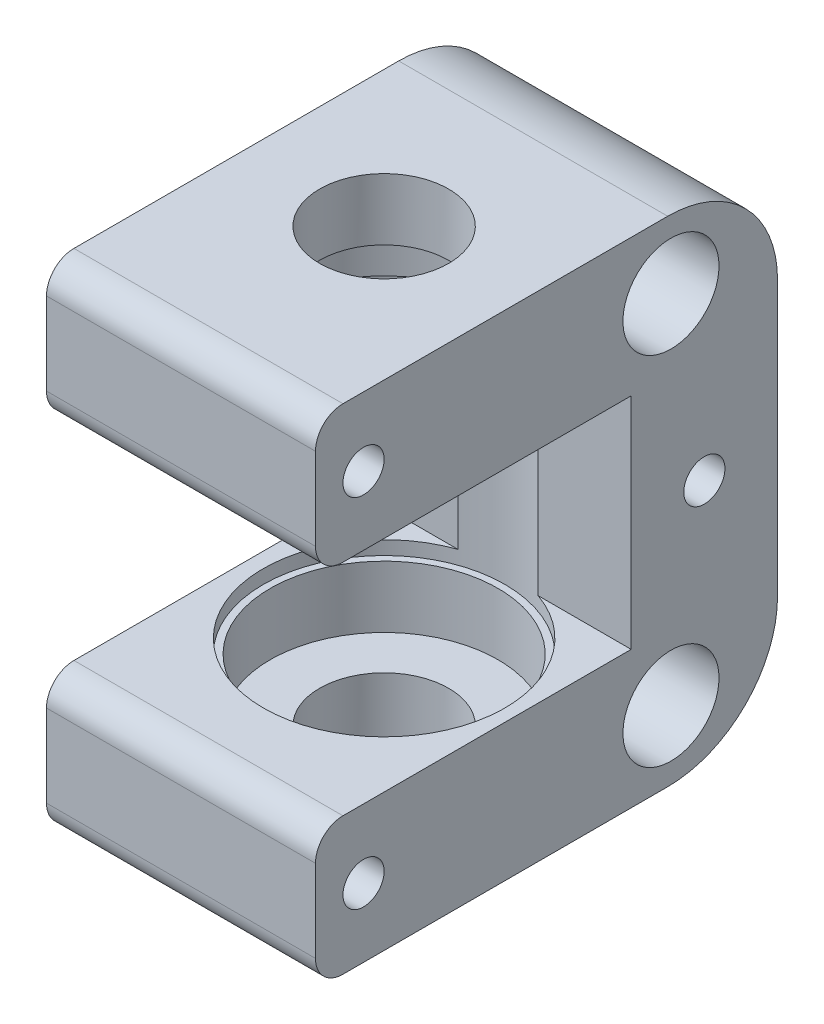
from build123d import *

# Parameters (mm, degrees)
SZKIC1_R                         = 3
DODANIE_WYCI_GNI_CIE1_DEPTH      = 60
WYTNIJ_WYCI_GNI_CIE1_START       = 43
SZKIC1_4_R                       = 8.3
WYTNIJ_WYCI_GNI_CIE1_DEPTH       = 26
WYTNIJ_WYCI_GNI_CIE2_START       = 38
WYTNIJ_WYCI_GNI_CIE2_DEPTH       = 16
WYTNIJ_WYCI_GNI_CIE3_START       = -12
WYTNIJ_WYCI_GNI_CIE3_DEPTH       = 12
WYTNIJ_WYCI_GNI_CIE4_DEPTH       = 12
WYTNIJ_WYCI_GNI_CIE5_START       = -26
WYTNIJ_WYCI_GNI_CIE5_DEPTH       = 16
SZKIC7_W                         = 1.4
SZKIC7_H                         = 16
WYTNIJ_WYCI_GNI_CIE6_DEPTH       = 527.501957094
SZKIC8_W                         = 5
SZKIC8_H                         = 10
DODANIE_WYCI_GNI_CIE2_DEPTH      = 16
DODANIE_WYCI_GNI_CIE3_DEPTH      = 10
DODANIE_WYCI_GNI_CIE4_DEPTH      = 10
SZKIC11_W                        = 6.4
SZKIC11_H                        = 16
DODANIE_WYCI_GNI_CIE5_DEPTH      = 11
DODANIE_WYCI_GNI_CIE6_DEPTH      = 10
DODANIE_WYCI_GNI_CIE7_START      = -10
DODANIE_WYCI_GNI_CIE7_DEPTH      = 10
SZKIC15_W                        = 6.4
SZKIC15_H                        = 16
DODANIE_WYCI_GNI_CIE8_DEPTH      = 3.4
SZKIC8_3_R                       = 1.5
WYTNIJ_WYCI_GNI_CIE7_DEPTH       = 527.66242587
SZKIC16_R                        = 4.7
WYTNIJ_WYCI_GNI_CIE8_DEPTH       = 526.928654544
WYTNIJ_WYCI_GNI_CIE9_START       = -0.5
SZKIC17_R                        = 8.3
WYTNIJ_WYCI_GNI_CIE9_DEPTH       = 0.5
SZKIC18_R                        = 8.3
WYTNIJ_WYCI_GNI_CIE10_DEPTH      = 0.5
SZKIC19_W                        = 28.661365339
SZKIC19_H                        = 12
WYTNIJ_WYCI_GNI_CIE11_DEPTH      = 527.501957094
SZKIC20_W                        = 4.261365339
SZKIC20_H                        = 36
DODANIE_WYCI_GNI_CIE9_DEPTH      = 14.4
SZKIC21_R                        = 1.8
SZKIC21_R_2                      = 1.5
WYTNIJ_WYCI_GNI_CIE12_DEPTH      = 526.430595629
SZKIC21_3_R                      = 1.5
WYTNIJ_WYCI_GNI_CIE13_DEPTH      = 16
ZAOKR_GLENIE1_R                  = 8
ZAOKR_GLENIE2_R                  = 2
SZKIC22_R                        = 3.5
WYTNIJ_WYCI_GNI_CIE14_DEPTH      = 5
WYTNIJ_WYCI_GNI_CIE15_DEPTH      = 17
WYTNIJ_WYCI_GNI_CIE15_DEPTH_BACK = 1
SZKIC23_R                        = 8.8
DODANIE_WYCI_GNI_CIE10_START     = 0.2
DODANIE_WYCI_GNI_CIE10_DEPTH     = 0.2


with BuildPart() as part:
    # Szkic1 → Dodanie-wyciągnięcie1 (new body)
    with BuildSketch(Plane(origin=(0, 0, 0), x_dir=(1, 0, 0), z_dir=(0, 1, 0))):
        with BuildLine():
            Line((-24.999980785, 522.873742718), (-29.999980785, 522.873742718))
            Line((-29.999980785, 522.873742718), (-29.999980785, 494.212377379))
            Line((-29.999980785, 494.212377379), (-20.299980785, 494.212377379))
            ThreePointArc((-20.299980785, 494.212377379), (-10.599980785, 503.912377379), (-20.299980785, 513.612377379))
            Line((-20.299980785, 513.612377379), (-24.999980785, 513.612377379))
            Line((-24.999980785, 513.612377379), (-24.999980785, 522.873742718))
        make_face()
        with Locations(Location((-20.299980785, 503.912377379, 0), (0, 0, 270))):
            Circle(SZKIC1_R, mode=Mode.SUBTRACT)
    extrude(amount=DODANIE_WYCI_GNI_CIE1_DEPTH)

    # Szkic1<4> → Wytnij-wyciągnięcie1 (cut)
    with BuildSketch(Plane(origin=(0, 0, 0), x_dir=(1, 0, 0), z_dir=(0, 1, 0)).offset(WYTNIJ_WYCI_GNI_CIE1_START)):
        with Locations(Location((-20.299980785, 503.912377379, 0), (0, 0, 270))):
            Circle(SZKIC1_4_R)
    extrude(amount=-WYTNIJ_WYCI_GNI_CIE1_DEPTH, mode=Mode.SUBTRACT)

    # Szkic1<6> → Wytnij-wyciągnięcie2 (cut)
    with BuildSketch(Plane(origin=(0, 0, 0), x_dir=(1, 0, 0), z_dir=(0, 1, 0)).offset(WYTNIJ_WYCI_GNI_CIE2_START)):
        with BuildLine():
            Line((-20.299980785, 512.212377379), (-29.999980785, 512.212377379))
            Line((-29.999980785, 512.212377379), (-29.999980785, 495.612377379))
            Line((-29.999980785, 495.612377379), (-20.299980785, 495.612377379))
            ThreePointArc((-20.299980785, 495.612377379), (-28.599980785, 503.912377379), (-20.299980785, 512.212377379))
        make_face()
    extrude(amount=-WYTNIJ_WYCI_GNI_CIE2_DEPTH, mode=Mode.SUBTRACT)

    # Szkic3 → Wytnij-wyciągnięcie3 (cut)
    with BuildSketch(Plane(origin=(0, 60, 0), x_dir=(1, 0, 0), z_dir=(0, 1, 0)).offset(WYTNIJ_WYCI_GNI_CIE3_START)):
        with BuildLine():
            Line((-24.999980785, 513.612377379), (-24.999980785, 494.212377379))
            Line((-24.999980785, 494.212377379), (-20.299980785, 494.212377379))
            ThreePointArc((-20.299980785, 494.212377379), (-10.599980785, 503.912377379), (-20.299980785, 513.612377379))
            Line((-20.299980785, 513.612377379), (-24.999980785, 513.612377379))
        make_face()
    extrude(amount=WYTNIJ_WYCI_GNI_CIE3_DEPTH, mode=Mode.SUBTRACT)

    # Szkic5 → Wytnij-wyciągnięcie4 (cut)
    with BuildSketch(Plane.XZ):
        with BuildLine():
            Line((-24.999980785, -513.612377379), (-20.299980785, -513.612377379))
            ThreePointArc((-20.299980785, -513.612377379), (-10.599980785, -503.912377379), (-20.299980785, -494.212377379))
            Line((-20.299980785, -494.212377379), (-24.999980785, -494.212377379))
            Line((-24.999980785, -494.212377379), (-24.999980785, -513.612377379))
        make_face()
    extrude(amount=-WYTNIJ_WYCI_GNI_CIE4_DEPTH, mode=Mode.SUBTRACT)

    # Szkic6 → Wytnij-wyciągnięcie5 (cut)
    with BuildSketch(Plane(origin=(0, 48, 0), x_dir=(1, 0, 0), z_dir=(0, 1, 0)).offset(WYTNIJ_WYCI_GNI_CIE5_START)):
        with BuildLine():
            Line((-20.299980785, 513.612377379), (-24.999980785, 513.612377379))
            Line((-24.999980785, 513.612377379), (-24.999980785, 494.212377379))
            Line((-24.999980785, 494.212377379), (-20.299980785, 494.212377379))
            ThreePointArc((-20.299980785, 494.212377379), (-10.599980785, 503.912377379), (-20.299980785, 513.612377379))
        make_face()
    extrude(amount=WYTNIJ_WYCI_GNI_CIE5_DEPTH, mode=Mode.SUBTRACT)

    # Szkic7 → Wytnij-wyciągnięcie6 (cut, through all)
    with BuildSketch(Plane(origin=(-24.999980785, 0, 0), x_dir=(0, 0, -1), z_dir=(1, 0, 0))):
        with Locations((494.912377379, 30)):
            Rectangle(SZKIC7_W, SZKIC7_H)
    extrude(amount=-WYTNIJ_WYCI_GNI_CIE6_DEPTH, mode=Mode.SUBTRACT)

    # Szkic8 → Dodanie-wyciągnięcie2 (add)
    with BuildSketch(Plane.ZY.offset(29.999980785)):
        with Locations((-491.712377379, 43)):
            Rectangle(SZKIC8_W, SZKIC8_H)
        with Locations((-516.112377379, 43)):
            Rectangle(SZKIC8_W, SZKIC8_H)
        with Locations((-516.112377379, 17)):
            Rectangle(SZKIC8_W, SZKIC8_H)
        with Locations((-491.712377379, 17)):
            Rectangle(SZKIC8_W, SZKIC8_H)
    extrude(amount=-DODANIE_WYCI_GNI_CIE2_DEPTH)

    # Szkic9 → Dodanie-wyciągnięcie3 (add)
    with BuildSketch(Plane.XZ.offset(-12)):
        with BuildLine():
            Line((-13.999980785, -513.612377379), (-20.299980785, -513.612377379))
            ThreePointArc((-20.299980785, -513.612377379), (-16.942426987, -513.012752783), (-13.999980785, -511.288012944))
            Line((-13.999980785, -511.288012944), (-13.999980785, -513.612377379))
        make_face()
        with BuildLine():
            Line((-13.999980785, -494.212377379), (-20.299980785, -494.212377379))
            ThreePointArc((-20.299980785, -494.212377379), (-16.942426987, -494.812001974), (-13.999980785, -496.536741813))
            Line((-13.999980785, -496.536741813), (-13.999980785, -494.212377379))
        make_face()
    extrude(amount=-DODANIE_WYCI_GNI_CIE3_DEPTH)

    # Szkic10 → Dodanie-wyciągnięcie4 (add)
    with BuildSketch(Plane.XZ.offset(-38)):
        with BuildLine():
            Line((-13.999980785, -513.612377379), (-20.299980785, -513.612377379))
            ThreePointArc((-20.299980785, -513.612377379), (-16.942426987, -513.012752783), (-13.999980785, -511.288012944))
            Line((-13.999980785, -511.288012944), (-13.999980785, -513.612377379))
        make_face()
        with BuildLine():
            Line((-13.999980785, -494.212377379), (-13.999980785, -496.536741813))
            ThreePointArc((-13.999980785, -496.536741813), (-16.942426987, -494.812001974), (-20.299980785, -494.212377379))
            Line((-20.299980785, -494.212377379), (-13.999980785, -494.212377379))
        make_face()
    extrude(amount=-DODANIE_WYCI_GNI_CIE4_DEPTH)

    # Szkic11 → Dodanie-wyciągnięcie5 (add)
    with BuildSketch(Plane(origin=(-24.999980785, 0, 0), x_dir=(0, 0, -1), z_dir=(1, 0, 0))):
        with Locations((515.412377379, 30)):
            Rectangle(SZKIC11_W, SZKIC11_H)
    extrude(amount=DODANIE_WYCI_GNI_CIE5_DEPTH)

    # Szkic12 → Dodanie-wyciągnięcie6 (add)
    with BuildSketch(Plane.XZ.offset(-12)):
        with BuildLine():
            ThreePointArc((-13.999980785, -496.536741813), (-11.490894566, -499.851589278), (-10.599980785, -503.912377379))
            Line((-10.599980785, -503.912377379), (-10.599980785, -489.212377379))
            Line((-10.599980785, -489.212377379), (-13.999980785, -489.212377379))
            Line((-13.999980785, -489.212377379), (-13.999980785, -496.536741813))
        make_face()
        with BuildLine():
            Line((-13.999980785, -511.288012944), (-13.999980785, -518.612377379))
            Line((-13.999980785, -518.612377379), (-10.599980785, -518.612377379))
            Line((-10.599980785, -518.612377379), (-10.599980785, -503.912377379))
            ThreePointArc((-10.599980785, -503.912377379), (-11.490894566, -507.973165479), (-13.999980785, -511.288012944))
        make_face()
    extrude(amount=-DODANIE_WYCI_GNI_CIE6_DEPTH)

    # Szkic13 → Dodanie-wyciągnięcie7 (add)
    with BuildSketch(Plane(origin=(0, 48, 0), x_dir=(1, 0, 0), z_dir=(0, 1, 0)).offset(DODANIE_WYCI_GNI_CIE7_START)):
        with BuildLine():
            ThreePointArc((-13.999980785, 511.288012944), (-11.490894566, 507.973165479), (-10.599980785, 503.912377379))
            Line((-10.599980785, 503.912377379), (-10.599980785, 518.612377379))
            Line((-10.599980785, 518.612377379), (-13.999980785, 518.612377379))
            Line((-13.999980785, 518.612377379), (-13.999980785, 511.288012944))
        make_face()
        with BuildLine():
            Line((-13.999980785, 489.212377379), (-10.599980785, 489.212377379))
            Line((-10.599980785, 489.212377379), (-10.599980785, 503.912377379))
            ThreePointArc((-10.599980785, 503.912377379), (-11.490894566, 499.851589278), (-13.999980785, 496.536741813))
            Line((-13.999980785, 496.536741813), (-13.999980785, 489.212377379))
        make_face()
    extrude(amount=DODANIE_WYCI_GNI_CIE7_DEPTH)

    # Szkic15 → Dodanie-wyciągnięcie8 (add)
    with BuildSketch(Plane(origin=(-13.999980785, 0, 0), x_dir=(0, 0, -1), z_dir=(1, 0, 0))):
        with Locations((515.412377379, 30)):
            Rectangle(SZKIC15_W, SZKIC15_H)
    extrude(amount=DODANIE_WYCI_GNI_CIE8_DEPTH)

    # Szkic8<3> → Wytnij-wyciągnięcie7 (cut, through all)
    with BuildSketch(Plane.ZY.offset(29.999980785)):
        with Locations((-492.712377379, 43)):
            Circle(SZKIC8_3_R)
        with Locations(Location((-515.112377379, 43, 0), (0, 0, 180))):
            Circle(SZKIC8_3_R)
        with Locations((-515.112377379, 17)):
            Circle(SZKIC8_3_R)
        with Locations(Location((-492.712377379, 17, 0), (0, 0, 180))):
            Circle(SZKIC8_3_R)
    extrude(amount=-WYTNIJ_WYCI_GNI_CIE7_DEPTH, mode=Mode.SUBTRACT)

    # Szkic16 → Wytnij-wyciągnięcie8 (cut, through all)
    with BuildSketch(Plane(origin=(0, 48, 0), x_dir=(1, 0, 0), z_dir=(0, 1, 0))):
        with Locations(Location((-20.299980785, 503.912377379, 0), (0, 0, 270))):
            Circle(SZKIC16_R)
    extrude(amount=-WYTNIJ_WYCI_GNI_CIE8_DEPTH, mode=Mode.SUBTRACT)

    # Szkic17 → Wytnij-wyciągnięcie9 (cut)
    with BuildSketch(Plane.XZ.offset(-43).offset(WYTNIJ_WYCI_GNI_CIE9_START)):
        with Locations(Location((-20.299980785, -503.912377379, 0), (0, 0, 90))):
            Circle(SZKIC17_R)
    extrude(amount=WYTNIJ_WYCI_GNI_CIE9_DEPTH, mode=Mode.SUBTRACT)

    # Szkic18 → Wytnij-wyciągnięcie10 (cut)
    with BuildSketch(Plane(origin=(0, 17, 0), x_dir=(1, 0, 0), z_dir=(0, 1, 0))):
        with Locations(Location((-20.299980785, 503.912377379, 0), (0, 0, 270))):
            Circle(SZKIC18_R)
    extrude(amount=-WYTNIJ_WYCI_GNI_CIE10_DEPTH, mode=Mode.SUBTRACT)

    # Szkic19 → Wytnij-wyciągnięcie11 (cut, through all)
    with BuildSketch(Plane(origin=(-24.999980785, 0, 0), x_dir=(0, 0, -1), z_dir=(1, 0, 0))):
        with Locations((508.543060049, 54)):
            Rectangle(SZKIC19_W, SZKIC19_H)
        with Locations((508.543060049, 6)):
            Rectangle(SZKIC19_W, SZKIC19_H)
    extrude(amount=-WYTNIJ_WYCI_GNI_CIE11_DEPTH, mode=Mode.SUBTRACT)

    # Szkic20 → Dodanie-wyciągnięcie9 (add)
    with BuildSketch(Plane(origin=(-24.999980785, 0, 0), x_dir=(0, 0, -1), z_dir=(1, 0, 0))):
        with Locations((520.743060048, 30)):
            Rectangle(SZKIC20_W, SZKIC20_H)
    extrude(amount=DODANIE_WYCI_GNI_CIE9_DEPTH)

    # Szkic21 → Wytnij-wyciągnięcie12 (cut, through all)
    # profile 1 of 2: a face of its own
    with BuildSketch(Plane(origin=(-10.599980785, 0, 0), x_dir=(0, 0, -1), z_dir=(1, 0, 0))):
        with Locations((515.112377379, 43)):
            Circle(SZKIC21_R)
        with Locations((515.112377379, 43)):
            Circle(SZKIC21_R_2, mode=Mode.SUBTRACT)
    # profile 2 of 2: a face of its own
    with BuildSketch(Plane(origin=(-10.599980785, 0, 0), x_dir=(0, 0, -1), z_dir=(1, 0, 0))):
        with Locations((515.112377379, 17)):
            Circle(SZKIC21_R)
        with Locations((515.112377379, 17)):
            Circle(SZKIC21_R_2, mode=Mode.SUBTRACT)
    extrude(amount=-WYTNIJ_WYCI_GNI_CIE12_DEPTH, mode=Mode.SUBTRACT)

    # Szkic21<3> → Wytnij-wyciągnięcie13 (cut)
    with BuildSketch(Plane(origin=(-10.599980785, 0, 0), x_dir=(0, 0, -1), z_dir=(1, 0, 0))):
        with Locations((517.543060048, 30)):
            Circle(SZKIC21_3_R)
    extrude(amount=-WYTNIJ_WYCI_GNI_CIE13_DEPTH, mode=Mode.SUBTRACT)

    # Zaokrąglenie1
    zaokr_glenie1_edges = [part.edges().sort_by_distance(p)[0] for p in [
        (-20.299980785, 48, -522.873742718),
        (-20.299980785, 12, -522.873742718),
    ]]
    fillet(zaokr_glenie1_edges, radius=ZAOKR_GLENIE1_R)

    # Zaokrąglenie2
    zaokr_glenie2_edges = [part.edges().sort_by_distance(p)[0] for p in [
        (-20.299980785, 48, -489.212377379),
        (-20.299980785, 38, -489.212377379),
        (-20.299980785, 22, -489.212377379),
        (-20.299980785, 12, -489.212377379),
    ]]
    fillet(zaokr_glenie2_edges, radius=ZAOKR_GLENIE2_R)

    # Szkic22 → Wytnij-wyciągnięcie14 (cut)
    with BuildSketch(Plane(origin=(-10.599980785, 0, 0), x_dir=(0, 0, -1), z_dir=(1, 0, 0))):
        with Locations((515.112377379, 43)):
            Circle(SZKIC22_R)
        with Locations((515.112377379, 17)):
            Circle(SZKIC22_R)
    extrude(amount=-WYTNIJ_WYCI_GNI_CIE14_DEPTH, mode=Mode.SUBTRACT)

    # Szkic23 → Wytnij-wyciągnięcie15 (cut, two sides: drawn at the far end of the back side and taken through both)
    with BuildSketch(Plane.XZ.offset(-38).offset(-WYTNIJ_WYCI_GNI_CIE15_DEPTH_BACK)):
        with Locations(Location((-20.299980785, -503.912377379, 0), (0, 0, 270))):
            Circle(SZKIC23_R)
    extrude(amount=WYTNIJ_WYCI_GNI_CIE15_DEPTH + WYTNIJ_WYCI_GNI_CIE15_DEPTH_BACK, mode=Mode.SUBTRACT)

    # Szkic25 → Dodanie-wyciągnięcie10 (add)
    with BuildSketch(Plane.ZY.offset(29.999980785).offset(DODANIE_WYCI_GNI_CIE10_START)):
        with BuildLine():
            Line((-489.212377379, 40), (-489.212377379, 46))
            ThreePointArc((-489.212377379, 46), (-489.798163816, 47.414213562), (-491.212377379, 48))
            Line((-491.212377379, 48), (-514.873742718, 48))
            ThreePointArc((-514.873742718, 48), (-520.530596967, 45.656854249), (-522.873742718, 40))
            Line((-522.873742718, 40), (-522.873742718, 20))
            ThreePointArc((-522.873742718, 20), (-520.530596967, 14.343145751), (-514.873742718, 12))
            Line((-514.873742718, 12), (-491.212377379, 12))
            ThreePointArc((-491.212377379, 12), (-489.798163816, 12.585786438), (-489.212377379, 14))
            Line((-489.212377379, 14), (-489.212377379, 20))
            ThreePointArc((-489.212377379, 20), (-489.798163816, 21.414213562), (-491.212377379, 22))
            Line((-491.212377379, 22), (-512.212377379, 22))
            Line((-512.212377379, 22), (-512.212377379, 38))
            Line((-512.212377379, 38), (-491.212377379, 38))
            ThreePointArc((-491.212377379, 38), (-489.798163816, 38.585786438), (-489.212377379, 40))
        make_face()
    extrude(amount=-DODANIE_WYCI_GNI_CIE10_DEPTH)


solid = part.part
